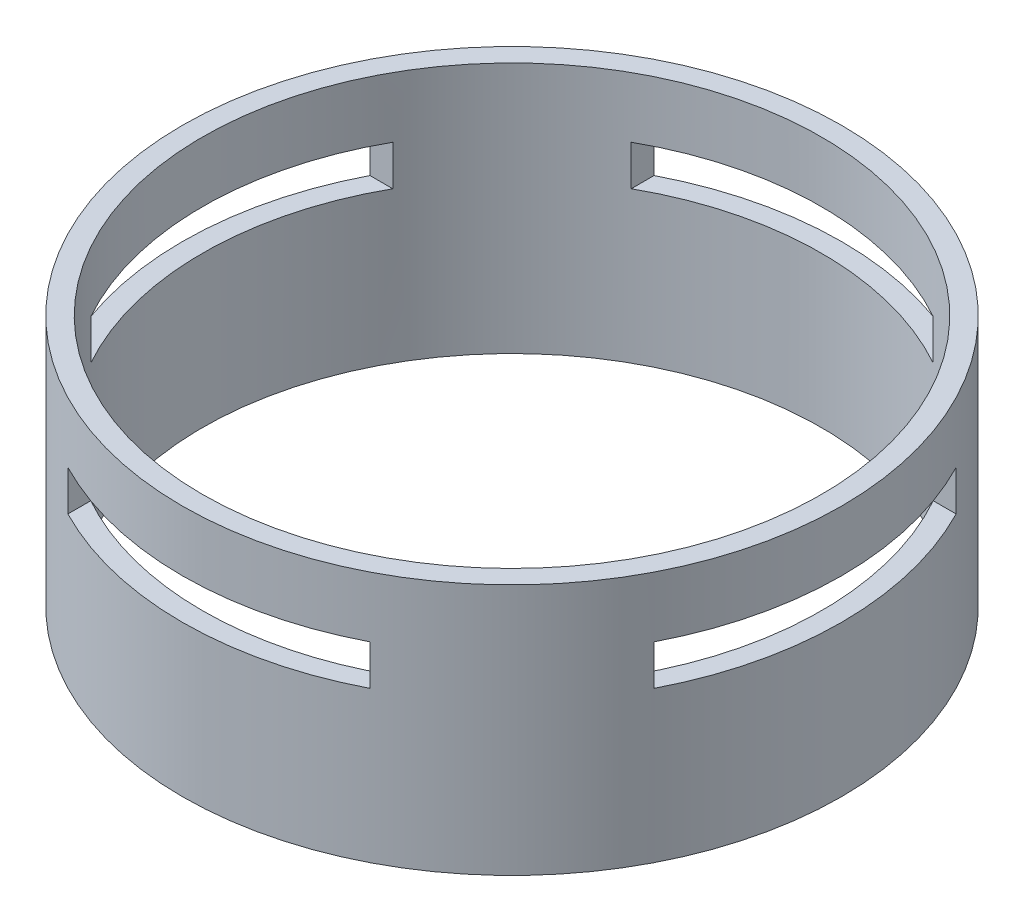
from build123d import *

# Parameters (mm, degrees)
ESQUISSE1_R                  = 32.75
ESQUISSE1_R_2                = 30.75
BOSS_EXTRU_1_DEPTH           = 25
ESQUISSE2_W                  = 30
ESQUISSE2_H                  = 4
ENL_V_MAT_EXTRU_1_DEPTH      = 53.631976972
R_P_TITION_CIRCULAIRE1_COUNT = 4


with BuildPart() as part:
    # Esquisse1 → Boss.-Extru.1 (new body)
    with BuildSketch(Plane(origin=(0, 0, 0), x_dir=(1, 0, 0), z_dir=(0, 1, 0))):
        with Locations(Location((0, 0, 0), (0, 0, 270))):
            Circle(ESQUISSE1_R)
        with Locations(Location((0, 0, 0), (0, 0, 270))):
            Circle(ESQUISSE1_R_2, mode=Mode.SUBTRACT)
    extrude(amount=BOSS_EXTRU_1_DEPTH)

    # Esquisse2 → Enlèv. mat.-Extru.1 (cut, through all)
    with BuildSketch(Plane.XY):
        with Locations((0, 17)):
            Rectangle(ESQUISSE2_W, ESQUISSE2_H)
    enl_v_mat_extru_1 = extrude(amount=-ENL_V_MAT_EXTRU_1_DEPTH, mode=Mode.SUBTRACT)

    # Répétition circulaire1: Enlèv. mat.-Extru.1 ×4 about axis
    r_p_tition_circulaire1_axis = Axis((0, 0, 0), (0, 1, 0))
    for i in range(1, R_P_TITION_CIRCULAIRE1_COUNT):
        add(enl_v_mat_extru_1.rotate(r_p_tition_circulaire1_axis, i * 360 / R_P_TITION_CIRCULAIRE1_COUNT), mode=Mode.SUBTRACT)


solid = part.part
